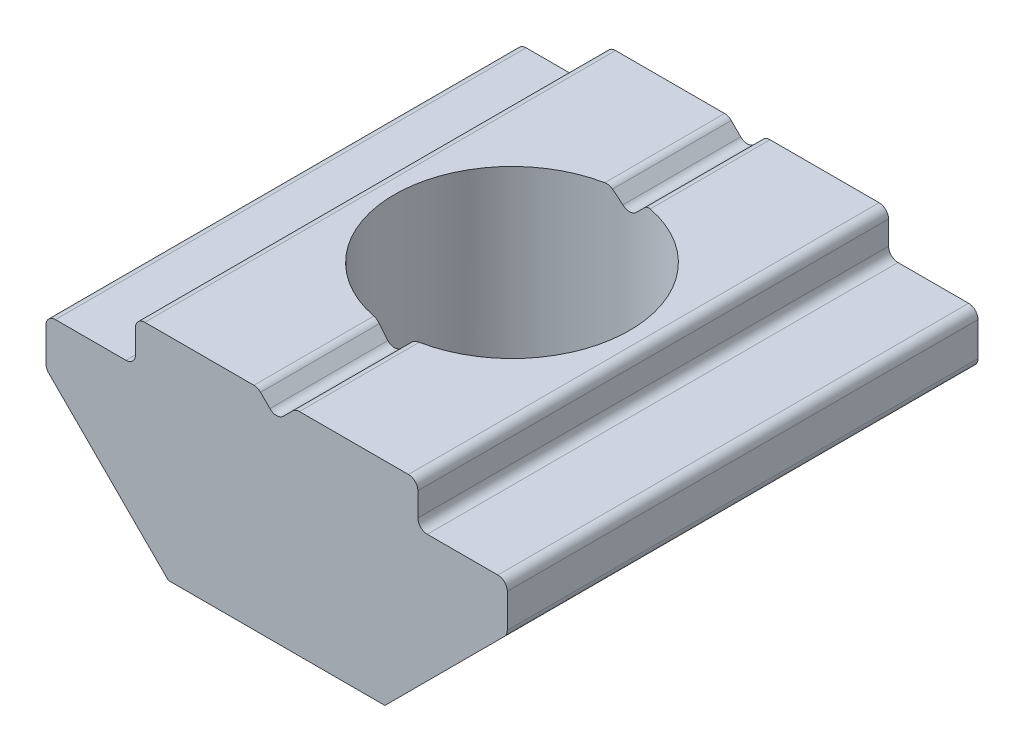
from build123d import *

# Parameters (mm, degrees)
EXTRUDE_BODY_DEPTH = 10
SKETCH2_W          = 1.9
SKETCH2_H          = 0.9
CUT_EXTRUDE1_DEPTH = 12.703418304
SKETCH3_W          = 1.9
SKETCH3_H          = 0.9
CUT_EXTRUDE2_DEPTH = 12.703418304
CUT_EXTRUDE3_DEPTH = 12.703418304
HOLE_REVOLVE_D     = 5
EDGE_FILLETS_R     = 0.2


with BuildPart() as part:
    # Sketch1 → Extrude Body (new body)
    with BuildSketch(Plane.XY.offset(5)):
        Polygon((4.9, -1), (4.9, 0.9), (-4.9, 0.9), (-4.9, -1), (-2.3, -3.6), (2.3, -3.6), align=None)
    extrude(amount=-EXTRUDE_BODY_DEPTH)

    # Sketch2 → Cut-Extrude1 (cut, through all)
    with BuildSketch(Plane(origin=(0, 0, -5), x_dir=(-1, 0, 0), z_dir=(0, 0, -1))):
        with Locations((3.95, 0.45)):
            Rectangle(SKETCH2_W, SKETCH2_H)
    extrude(amount=-CUT_EXTRUDE1_DEPTH, mode=Mode.SUBTRACT)

    # Sketch3 → Cut-Extrude2 (cut, through all)
    with BuildSketch(Plane(origin=(0, 0, -5), x_dir=(-1, 0, 0), z_dir=(0, 0, -1))):
        with Locations((-3.95, 0.45)):
            Rectangle(SKETCH3_W, SKETCH3_H)
    extrude(amount=-CUT_EXTRUDE2_DEPTH, mode=Mode.SUBTRACT)

    # Sketch4 → Cut-Extrude3 (cut, through all)
    with BuildSketch(Plane(origin=(0, 0, -5), x_dir=(-1, 0, 0), z_dir=(0, 0, -1))):
        Polygon((0.4, 0.9), (-0.4, 0.9), (0, 0.5), align=None)
    extrude(amount=-CUT_EXTRUDE3_DEPTH, mode=Mode.SUBTRACT)

    # Hole Revolve (through all)
    with Locations(Plane(origin=(0, -3.6, 0), x_dir=(-1, 0, 0), z_dir=(0, -1, 0))):
        with Locations((0, 0)):
            Hole(HOLE_REVOLVE_D / 2)

    # Edge Fillets
    edge_fillets_edges = [part.edges().sort_by_distance(p)[0] for p in [
        (4.9, 0, 0),
        (3, 0, 0),
        (-4.9, -1, 0),
        (3, 0.9, 0),
        (-3, 0, 0),
        (0.4, 0.9, -3.733896268),
        (0, 0.5, 3.75),
        (-0.4, 0.9, -3.733896268),
        (4.9, -1, 0),
        (-3, 0.9, 0),
        (0, 0.5, -3.75),
        (-0.4, 0.9, 3.733896268),
        (-4.9, 0, 0),
        (-2.3, -3.6, -2.989897949),
        (0.4, 0.9, 3.733896268),
        (2.3, -3.6, -2.989897949),
    ]]
    fillet(edge_fillets_edges, radius=EDGE_FILLETS_R)


solid = part.part
